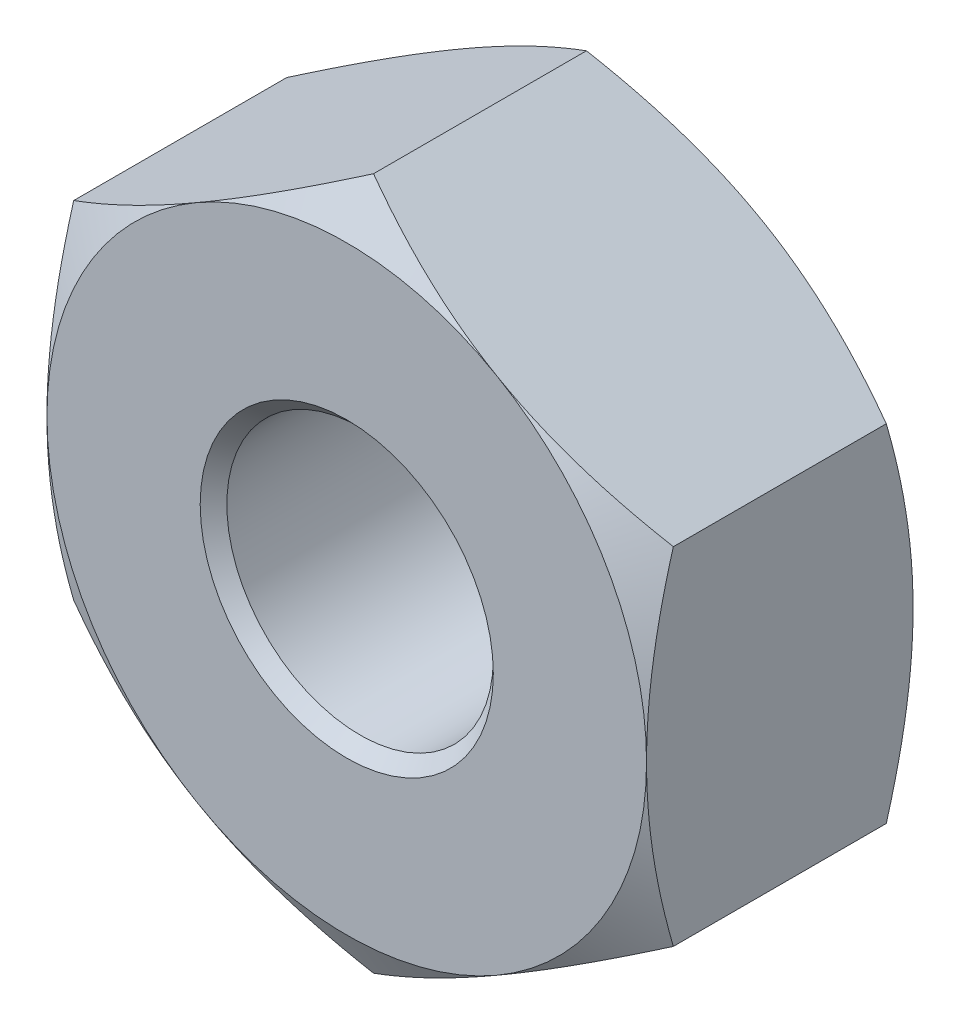
from build123d import *

# Parameters (mm, degrees)
CROQUIS1_R              = 1
SALIENTE_EXTRUIR1_DEPTH = 2
CROQUIS3_OUTSIDE_W      = 14.86
CROQUIS3_OUTSIDE_H      = 15.556
CROQUIS3_OUTSIDE_R      = 2.25
CORTAR_EXTRUIR1_DEPTH   = 2
CORTAR_EXTRUIR1_DRAFT   = 60
CROQUIS4_OUTSIDE_W      = 14.86
CROQUIS4_OUTSIDE_H      = 15.556
CROQUIS4_OUTSIDE_R      = 2.25
CORTAR_EXTRUIR4_DEPTH   = 2
CORTAR_EXTRUIR4_DRAFT   = -60
CHAFL_N1_SIZE           = 0.1


with BuildPart() as part:
    # Croquis1 → Saliente-Extruir1 (new body)
    with BuildSketch(Plane.XY):
        Polygon((0, -2.598076211), (2.25, -1.299038106), (2.25, 1.299038106), (0, 2.598076211), (-2.25, 1.299038106), (-2.25, -1.299038106), align=None)
        Circle(CROQUIS1_R, mode=Mode.SUBTRACT)
    extrude(amount=SALIENTE_EXTRUIR1_DEPTH)


with BuildPart() as cortar_extruir1_tool:
    # Croquis3 outside → Cortar-Extruir1 (with draft: the straight prism first)
    with BuildSketch(Plane.XY):
        Rectangle(CROQUIS3_OUTSIDE_W, CROQUIS3_OUTSIDE_H)
        Circle(CROQUIS3_OUTSIDE_R, mode=Mode.SUBTRACT)
    extrude(amount=CORTAR_EXTRUIR1_DEPTH)
    # Cortar-Extruir1: the draft: its side faces are tilted about the plane it starts from
    cortar_extruir1_sides = [cortar_extruir1_tool.faces().sort_by_distance(p)[0] for p in [
        (0, -7.778, 1),
        (7.43, 0, 1),
        (0, 7.778, 1),
        (-7.43, 0, 1),
        (-2.25, 0, 1),
    ]]
    draft(cortar_extruir1_sides, Plane.XY, CORTAR_EXTRUIR1_DRAFT)


with BuildPart() as part_1:
    add(part.part)

    # Cortar-Extruir1: cut by cortar_extruir1_tool
    add(cortar_extruir1_tool.part, mode=Mode.SUBTRACT)


with BuildPart() as cortar_extruir4_tool:
    # Croquis4 outside → Cortar-Extruir4 (with draft: the straight prism first)
    with BuildSketch(Plane.XY.offset(2)):
        Rectangle(CROQUIS4_OUTSIDE_W, CROQUIS4_OUTSIDE_H)
        Circle(CROQUIS4_OUTSIDE_R, mode=Mode.SUBTRACT)
    extrude(amount=-CORTAR_EXTRUIR4_DEPTH)
    # Cortar-Extruir4: the draft: its side faces are tilted about the plane it starts from
    cortar_extruir4_sides = [cortar_extruir4_tool.faces().sort_by_distance(p)[0] for p in [
        (0, -7.778, 1),
        (7.43, 0, 1),
        (0, 7.778, 1),
        (-7.43, 0, 1),
        (-2.25, 0, 1),
    ]]
    draft(cortar_extruir4_sides, Plane.XY.offset(2), CORTAR_EXTRUIR4_DRAFT)


with BuildPart() as part_2:
    add(part_1.part)

    # Cortar-Extruir4: cut by cortar_extruir4_tool
    add(cortar_extruir4_tool.part, mode=Mode.SUBTRACT)

    # Chaflán1
    chafl_n1_edges = [part_2.edges().sort_by_distance(p)[0] for p in [
        (-1, 0, 0),
        (-1, 0, 2),
    ]]
    chamfer(chafl_n1_edges, length=CHAFL_N1_SIZE)


solid = part_2.part
